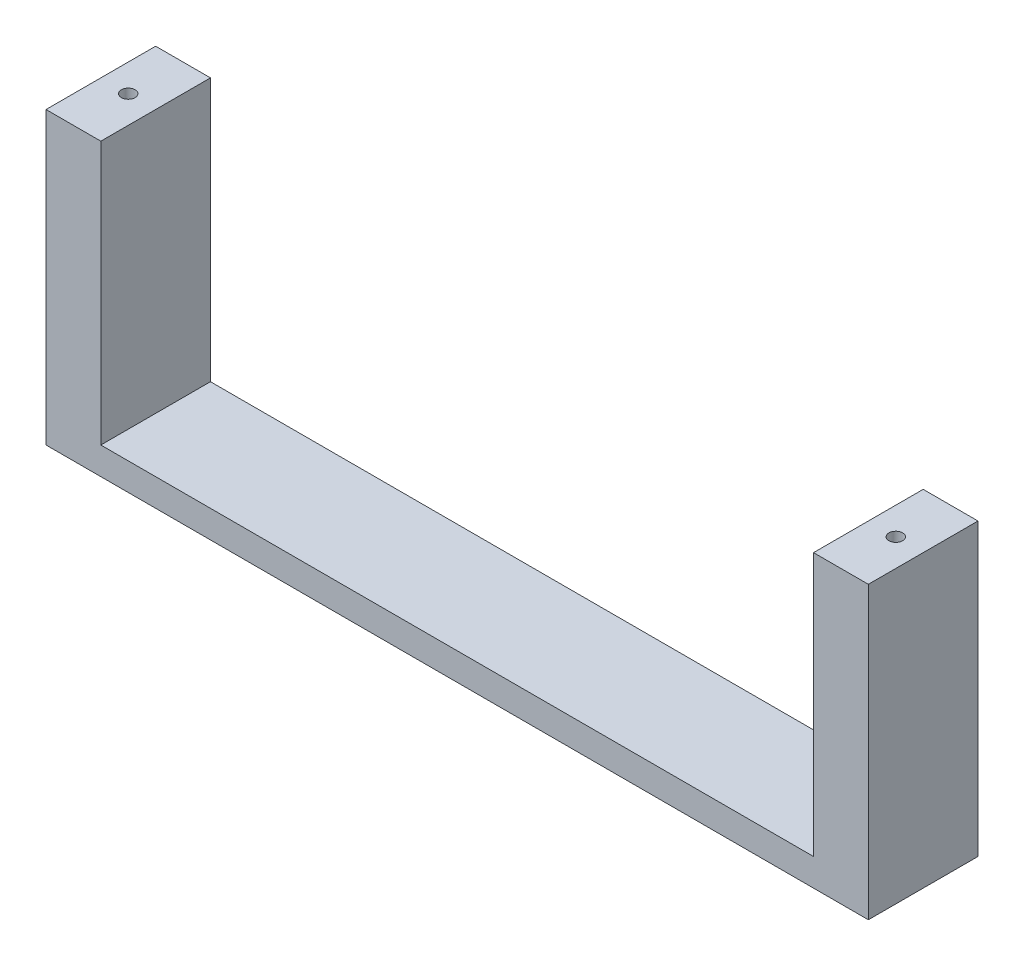
from build123d import *

# Parameters (mm, degrees)
CROQUIS1_W              = 150
CROQUIS1_H              = 20
SALIENTE_EXTRUIR1_DEPTH = 5
CROQUIS2_W              = 10
CROQUIS2_H              = 20
SALIENTE_EXTRUIR2_DEPTH = 48
CROQUIS3_R              = 1.25
CORTAR_EXTRUIR1_DEPTH   = 10


with BuildPart() as part:
    # Croquis1 → Saliente-Extruir1 (new body)
    with BuildSketch(Plane(origin=(0, 0, 0), x_dir=(1, 0, 0), z_dir=(0, 1, 0))):
        Rectangle(CROQUIS1_W, CROQUIS1_H)
    extrude(amount=SALIENTE_EXTRUIR1_DEPTH)

    # Croquis2 → Saliente-Extruir2 (add)
    with BuildSketch(Plane(origin=(0, 5, 0), x_dir=(1, 0, 0), z_dir=(0, 1, 0))):
        with Locations((70, 0)):
            Rectangle(CROQUIS2_W, CROQUIS2_H)
        with Locations((-70, 0)):
            Rectangle(CROQUIS2_W, CROQUIS2_H)
    extrude(amount=SALIENTE_EXTRUIR2_DEPTH)

    # Croquis3 → Cortar-Extruir1 (cut)
    with BuildSketch(Plane(origin=(0, 53, 0), x_dir=(1, 0, 0), z_dir=(0, 1, 0))):
        with Locations(Location((-70, 0, 0), (0, 0, 270))):
            Circle(CROQUIS3_R)
        with Locations(Location((70, 0, 0), (0, 0, 270))):
            Circle(CROQUIS3_R)
    extrude(amount=-CORTAR_EXTRUIR1_DEPTH, mode=Mode.SUBTRACT)


solid = part.part
